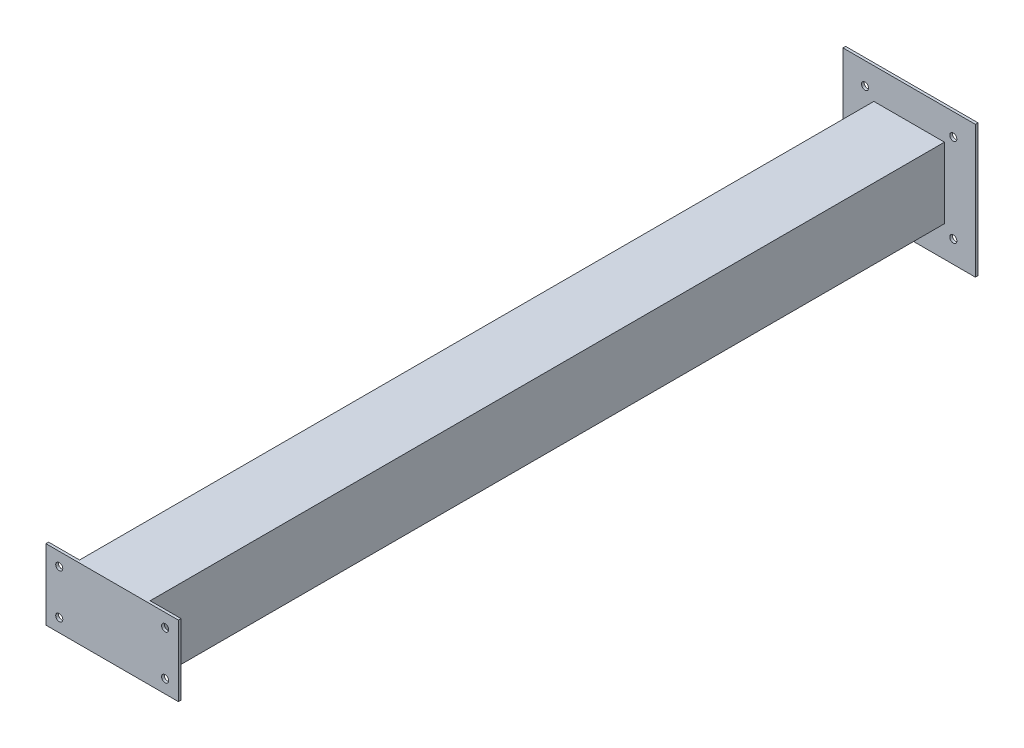
from build123d import *

# Parameters (mm, degrees)
SKETCH1_W           = 80
SKETCH1_H           = 80
BOSS_EXTRUDE1_DEPTH = 900
SHELL1_T            = -3
SKETCH2_W           = 150
SKETCH2_H           = 150
SKETCH2_R           = 4
BOSS_EXTRUDE2_DEPTH = 3
SKETCH6_W           = 150
SKETCH6_H           = 80
BOSS_EXTRUDE4_DEPTH = 3
CUT_EXTRUDE3_REACH  = 914.187
SKETCH7_R           = 4
BOSS_EXTRUDE5_DEPTH = 1.5


with BuildPart() as part:
    # Sketch1 → Boss-Extrude1 (new body)
    with BuildSketch(Plane.XY):
        Rectangle(SKETCH1_W, SKETCH1_H)
    extrude(amount=BOSS_EXTRUDE1_DEPTH)

    # Shell1
    shell1_openings = [part.faces().sort_by_distance(p)[0] for p in [
        (0, 0, 900),
        (0, 0, 0),
    ]]
    offset(amount=SHELL1_T, openings=shell1_openings, kind=Kind.INTERSECTION)

    # Sketch2 → Boss-Extrude2 (add)
    with BuildSketch(Plane(origin=(0, 0, 0), x_dir=(-1, 0, 0), z_dir=(0, 0, -1))):
        Rectangle(SKETCH2_W, SKETCH2_H)
        with Locations((50, 50)):
            Circle(SKETCH2_R, mode=Mode.SUBTRACT)
        with Locations(Location((-50, 50, 0), (0, 0, 180))):
            Circle(SKETCH2_R, mode=Mode.SUBTRACT)
        with Locations(Location((50, -50, 0), (0, 0, 180))):
            Circle(SKETCH2_R, mode=Mode.SUBTRACT)
        with Locations((-50, -50)):
            Circle(SKETCH2_R, mode=Mode.SUBTRACT)
    extrude(amount=BOSS_EXTRUDE2_DEPTH)

    # Sketch6 → Boss-Extrude4 (add)
    with BuildSketch(Plane.XY.offset(900)):
        Rectangle(SKETCH6_W, SKETCH6_H)
    extrude(amount=BOSS_EXTRUDE4_DEPTH)

    # Sketch7 → Cut-Extrude3 (cut, up to next)
    with BuildSketch(Plane.XY.offset(903), mode=Mode.PRIVATE) as cut_extrude3_sk1:
        with Locations((-60, 25)):
            Circle(SKETCH7_R)
    cut_extrude3_tool1 = extrude(cut_extrude3_sk1.sketch, amount=-CUT_EXTRUDE3_REACH, mode=Mode.PRIVATE) & part.part
    # Sketch7 → Cut-Extrude3 (cut, up to next)
    with BuildSketch(Plane.XY.offset(903), mode=Mode.PRIVATE) as cut_extrude3_sk2:
        with Locations((60, 25)):
            Circle(SKETCH7_R)
    cut_extrude3_tool2 = extrude(cut_extrude3_sk2.sketch, amount=-CUT_EXTRUDE3_REACH, mode=Mode.PRIVATE) & part.part
    # Sketch7 → Cut-Extrude3 (cut, up to next)
    with BuildSketch(Plane.XY.offset(903), mode=Mode.PRIVATE) as cut_extrude3_sk3:
        with Locations((60, -25)):
            Circle(SKETCH7_R)
    cut_extrude3_tool3 = extrude(cut_extrude3_sk3.sketch, amount=-CUT_EXTRUDE3_REACH, mode=Mode.PRIVATE) & part.part
    # Sketch7 → Cut-Extrude3 (cut, up to next)
    with BuildSketch(Plane.XY.offset(903), mode=Mode.PRIVATE) as cut_extrude3_sk4:
        with Locations((-60, -25)):
            Circle(SKETCH7_R)
    cut_extrude3_tool4 = extrude(cut_extrude3_sk4.sketch, amount=-CUT_EXTRUDE3_REACH, mode=Mode.PRIVATE) & part.part
    add(cut_extrude3_tool1.solids().sort_by_distance((-60, 25, 903))[0], mode=Mode.SUBTRACT)
    add(cut_extrude3_tool2.solids().sort_by_distance((60, 25, 903))[0], mode=Mode.SUBTRACT)
    add(cut_extrude3_tool3.solids().sort_by_distance((60, -25, 903))[0], mode=Mode.SUBTRACT)
    add(cut_extrude3_tool4.solids().sort_by_distance((-60, -25, 903))[0], mode=Mode.SUBTRACT)

    # Sketch10 → Boss-Extrude5 (add, symmetric)
    with BuildSketch(Plane(origin=(0, 0, 0), x_dir=(1, 0, 0), z_dir=(0, 1, 0))):
        Polygon((-40, -900), (-75, -900), (-40, -865), align=None)
    boss_extrude5 = extrude(amount=BOSS_EXTRUDE5_DEPTH, both=True)

    # Mirror3: Boss-Extrude5 across plane
    add(boss_extrude5.mirror(Plane(origin=(0, 0, 0), x_dir=(0, 0, 1), z_dir=(1, 0, 0))))


solid = part.part
